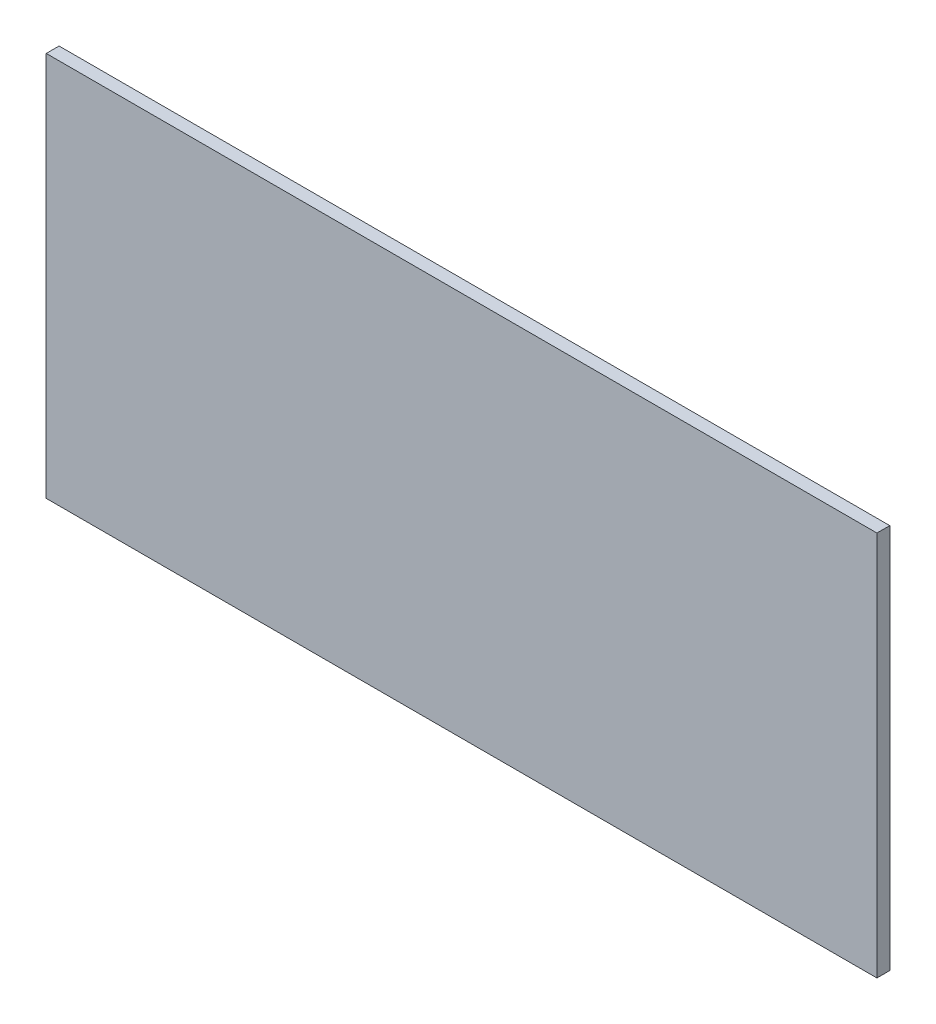
from build123d import *

# Parameters (mm, degrees)
SKETCH_1_W      = 194
SKETCH_1_H      = 90
EXTRUDE_1_DEPTH = 3


with BuildPart() as part:
    # 草圖1 → 填料-伸長1 (new body)
    with BuildSketch(Plane.XY):
        with Locations((-3, 0)):
            Rectangle(SKETCH_1_W, SKETCH_1_H)
    extrude(amount=EXTRUDE_1_DEPTH)


solid = part.part
